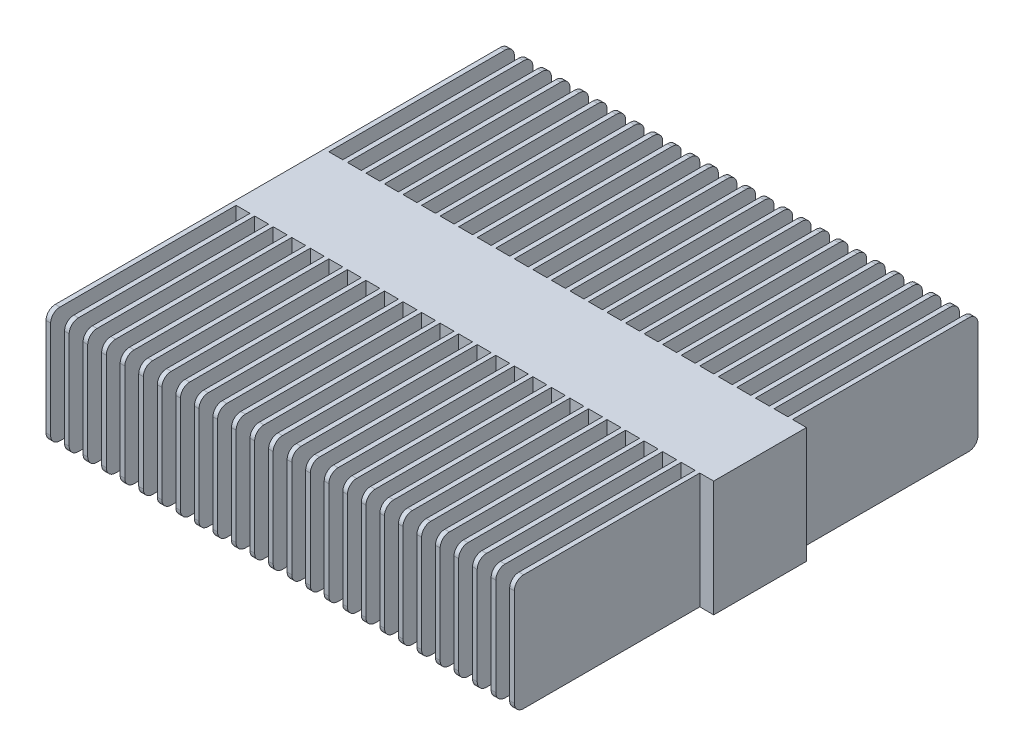
from build123d import *

# Parameters (mm, degrees)
SKETCH_1_W          = 104
SKETCH_1_H          = 25
EXTRUDE_1_DEPTH     = 100
FILLET_1_R          = 2
SKETCH_2_W          = 3
SKETCH_2_H          = 25
CUT_EXTRUDE_1_DEPTH = 40
SKETCH_3_W          = 3
SKETCH_3_H          = 25
CUT_EXTRUDE_2_DEPTH = 40


with BuildPart() as part:
    # 스케치1 → 보스-돌출1 (new body)
    with BuildSketch(Plane.XY):
        with Locations((52, 12.5)):
            Rectangle(SKETCH_1_W, SKETCH_1_H)
    extrude(amount=EXTRUDE_1_DEPTH)

    # 필렛1
    fillet_1_edges = [part.edges().sort_by_distance(p)[0] for p in [
        (52, 25, 100),
        (52, 25, 0),
        (52, 0, 0),
        (52, 0, 100),
    ]]
    fillet(fillet_1_edges, radius=FILLET_1_R)

    # 스케치2 → 컷-돌출1 (cut)
    with BuildSketch(Plane.XY.offset(100)):
        with Locations((2.5, 12.5)):
            Rectangle(SKETCH_2_W, SKETCH_2_H)
        with Locations((6.5, 12.5)):
            Rectangle(SKETCH_2_W, SKETCH_2_H)
        with Locations((10.5, 12.5)):
            Rectangle(SKETCH_2_W, SKETCH_2_H)
        with Locations((14.5, 12.5)):
            Rectangle(SKETCH_2_W, SKETCH_2_H)
        with Locations((18.5, 12.5)):
            Rectangle(SKETCH_2_W, SKETCH_2_H)
        with Locations((22.5, 12.5)):
            Rectangle(SKETCH_2_W, SKETCH_2_H)
        with Locations((26.5, 12.5)):
            Rectangle(SKETCH_2_W, SKETCH_2_H)
        with Locations((30.5, 12.5)):
            Rectangle(SKETCH_2_W, SKETCH_2_H)
        with Locations((34.5, 12.5)):
            Rectangle(SKETCH_2_W, SKETCH_2_H)
        with Locations((38.5, 12.5)):
            Rectangle(SKETCH_2_W, SKETCH_2_H)
        with Locations((42.5, 12.5)):
            Rectangle(SKETCH_2_W, SKETCH_2_H)
        with Locations((46.5, 12.5)):
            Rectangle(SKETCH_2_W, SKETCH_2_H)
        with Locations((50.5, 12.5)):
            Rectangle(SKETCH_2_W, SKETCH_2_H)
        with Locations((54.5, 12.5)):
            Rectangle(SKETCH_2_W, SKETCH_2_H)
        with Locations((58.5, 12.5)):
            Rectangle(SKETCH_2_W, SKETCH_2_H)
        with Locations((62.5, 12.5)):
            Rectangle(SKETCH_2_W, SKETCH_2_H)
        with Locations((66.5, 12.5)):
            Rectangle(SKETCH_2_W, SKETCH_2_H)
        with Locations((70.5, 12.5)):
            Rectangle(SKETCH_2_W, SKETCH_2_H)
        with Locations((74.5, 12.5)):
            Rectangle(SKETCH_2_W, SKETCH_2_H)
        with Locations((78.5, 12.5)):
            Rectangle(SKETCH_2_W, SKETCH_2_H)
        with Locations((82.5, 12.5)):
            Rectangle(SKETCH_2_W, SKETCH_2_H)
        with Locations((86.5, 12.5)):
            Rectangle(SKETCH_2_W, SKETCH_2_H)
        with Locations((90.5, 12.5)):
            Rectangle(SKETCH_2_W, SKETCH_2_H)
        with Locations((94.5, 12.5)):
            Rectangle(SKETCH_2_W, SKETCH_2_H)
        with Locations((98.5, 12.5)):
            Rectangle(SKETCH_2_W, SKETCH_2_H)
        with Locations((102.5, 12.5)):
            Rectangle(SKETCH_2_W, SKETCH_2_H)
    extrude(amount=-CUT_EXTRUDE_1_DEPTH, mode=Mode.SUBTRACT)

    # 스케치3 → 컷-돌출2 (cut)
    with BuildSketch(Plane(origin=(0, 0, 0), x_dir=(-1, 0, 0), z_dir=(0, 0, -1))):
        with Locations((-2.5, 12.5)):
            Rectangle(SKETCH_3_W, SKETCH_3_H)
        with Locations((-6.5, 12.5)):
            Rectangle(SKETCH_3_W, SKETCH_3_H)
        with Locations((-10.5, 12.5)):
            Rectangle(SKETCH_3_W, SKETCH_3_H)
        with Locations((-14.5, 12.5)):
            Rectangle(SKETCH_3_W, SKETCH_3_H)
        with Locations((-18.5, 12.5)):
            Rectangle(SKETCH_3_W, SKETCH_3_H)
        with Locations((-22.5, 12.5)):
            Rectangle(SKETCH_3_W, SKETCH_3_H)
        with Locations((-26.5, 12.5)):
            Rectangle(SKETCH_3_W, SKETCH_3_H)
        with Locations((-30.5, 12.5)):
            Rectangle(SKETCH_3_W, SKETCH_3_H)
        with Locations((-34.5, 12.5)):
            Rectangle(SKETCH_3_W, SKETCH_3_H)
        with Locations((-38.5, 12.5)):
            Rectangle(SKETCH_3_W, SKETCH_3_H)
        with Locations((-42.5, 12.5)):
            Rectangle(SKETCH_3_W, SKETCH_3_H)
        with Locations((-46.5, 12.5)):
            Rectangle(SKETCH_3_W, SKETCH_3_H)
        with Locations((-50.5, 12.5)):
            Rectangle(SKETCH_3_W, SKETCH_3_H)
        with Locations((-54.5, 12.5)):
            Rectangle(SKETCH_3_W, SKETCH_3_H)
        with Locations((-58.5, 12.5)):
            Rectangle(SKETCH_3_W, SKETCH_3_H)
        with Locations((-62.5, 12.5)):
            Rectangle(SKETCH_3_W, SKETCH_3_H)
        with Locations((-66.5, 12.5)):
            Rectangle(SKETCH_3_W, SKETCH_3_H)
        with Locations((-70.5, 12.5)):
            Rectangle(SKETCH_3_W, SKETCH_3_H)
        with Locations((-74.5, 12.5)):
            Rectangle(SKETCH_3_W, SKETCH_3_H)
        with Locations((-78.5, 12.5)):
            Rectangle(SKETCH_3_W, SKETCH_3_H)
        with Locations((-82.5, 12.5)):
            Rectangle(SKETCH_3_W, SKETCH_3_H)
        with Locations((-86.5, 12.5)):
            Rectangle(SKETCH_3_W, SKETCH_3_H)
        with Locations((-90.5, 12.5)):
            Rectangle(SKETCH_3_W, SKETCH_3_H)
        with Locations((-94.5, 12.5)):
            Rectangle(SKETCH_3_W, SKETCH_3_H)
        with Locations((-98.5, 12.5)):
            Rectangle(SKETCH_3_W, SKETCH_3_H)
        with Locations((-102.5, 12.5)):
            Rectangle(SKETCH_3_W, SKETCH_3_H)
    extrude(amount=-CUT_EXTRUDE_2_DEPTH, mode=Mode.SUBTRACT)


solid = part.part
